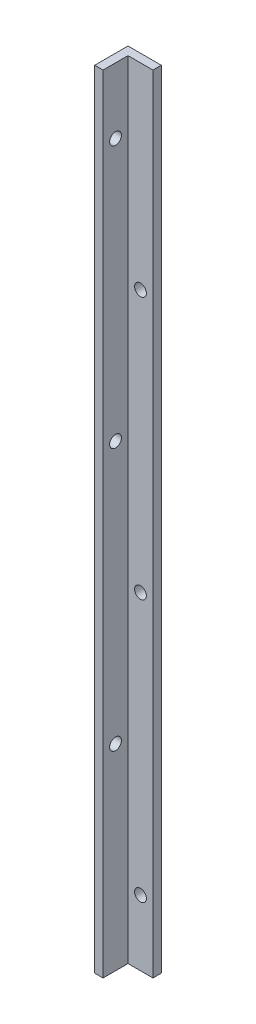
from build123d import *

# Parameters (mm, degrees)
BOSS_EXTRUDE1_DEPTH = 300
SKETCH2_R           = 2.25
CUT_EXTRUDE1_DEPTH  = 10
SKETCH3_R           = 2.25
CUT_EXTRUDE2_DEPTH  = 10


with BuildPart() as part:
    # Sketch1 → Boss-Extrude1 (new body)
    with BuildSketch(Plane(origin=(0, 0, 0), x_dir=(1, 0, 0), z_dir=(0, 1, 0))):
        Polygon((0, 0), (0, -12.7), (3.18, -12.7), (3.18, -3.18), (12.7, -3.18), (12.7, 0), align=None)
    extrude(amount=BOSS_EXTRUDE1_DEPTH)

    # Sketch2 → Cut-Extrude1 (cut)
    with BuildSketch(Plane(origin=(3.18, 0, 0), x_dir=(0, 0, -1), z_dir=(1, 0, 0))):
        with Locations((-7.94, 275)):
            Circle(SKETCH2_R)
        with Locations((-7.94, 175)):
            Circle(SKETCH2_R)
        with Locations((-7.94, 75)):
            Circle(SKETCH2_R)
    extrude(amount=-CUT_EXTRUDE1_DEPTH, mode=Mode.SUBTRACT)

    # Sketch3 → Cut-Extrude2 (cut)
    with BuildSketch(Plane.XY.offset(3.18)):
        with Locations((7.94, 225)):
            Circle(SKETCH3_R)
        with Locations((7.94, 125)):
            Circle(SKETCH3_R)
        with Locations((7.94, 25)):
            Circle(SKETCH3_R)
    extrude(amount=-CUT_EXTRUDE2_DEPTH, mode=Mode.SUBTRACT)


solid = part.part
